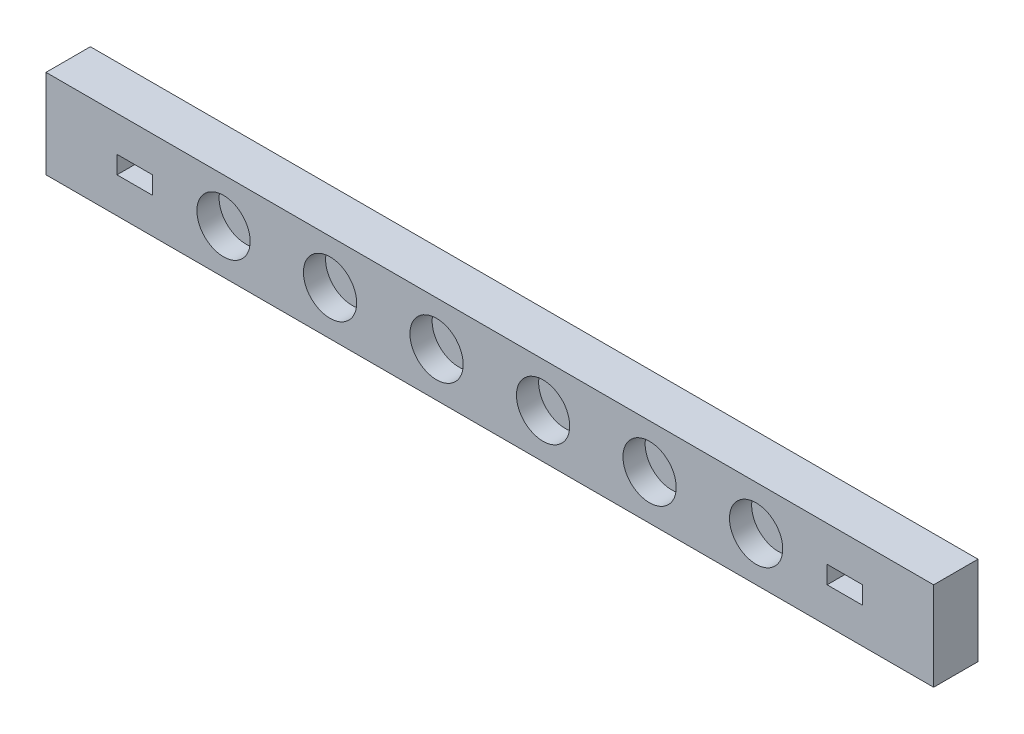
from build123d import *

# Parameters (mm, degrees)
SKETCH1_W           = 900
SKETCH1_H           = 100
BOSS_EXTRUDE1_DEPTH = 50
SKETCH2_R           = 30
SKETCH2_W           = 40
SKETCH2_H           = 20
CUT_EXTRUDE1_DEPTH  = 25
SKETCH3_W           = 50
SKETCH3_H           = 50
BOSS_EXTRUDE3_DEPTH = 100


with BuildPart() as part:
    # Sketch1 → Boss-Extrude1 (new body)
    with BuildSketch(Plane.XY):
        Rectangle(SKETCH1_W, SKETCH1_H)
    extrude(amount=BOSS_EXTRUDE1_DEPTH)

    # Sketch2 → Cut-Extrude1 (cut)
    with BuildSketch(Plane.XY.offset(50)):
        with Locations((-300, 0)):
            Circle(SKETCH2_R)
        with Locations((-180, 0)):
            Circle(SKETCH2_R)
        with Locations((-60, 0)):
            Circle(SKETCH2_R)
        with Locations((60, 0)):
            Circle(SKETCH2_R)
        with Locations((180, 0)):
            Circle(SKETCH2_R)
        with Locations((300, 0)):
            Circle(SKETCH2_R)
        with Locations((400, 0)):
            Rectangle(SKETCH2_W, SKETCH2_H)
        with Locations((-400, 0)):
            Rectangle(SKETCH2_W, SKETCH2_H)
    extrude(amount=-CUT_EXTRUDE1_DEPTH, mode=Mode.SUBTRACT)

    # Sketch3 → Boss-Extrude3 (add)
    with BuildSketch(Plane(origin=(0, 50, 0), x_dir=(1, 0, 0), z_dir=(0, 1, 0))):
        with Locations((475, -25)):
            Rectangle(SKETCH3_W, SKETCH3_H)
        with Locations((-475, -25)):
            Rectangle(SKETCH3_W, SKETCH3_H)
    extrude(amount=-BOSS_EXTRUDE3_DEPTH)


solid = part.part
